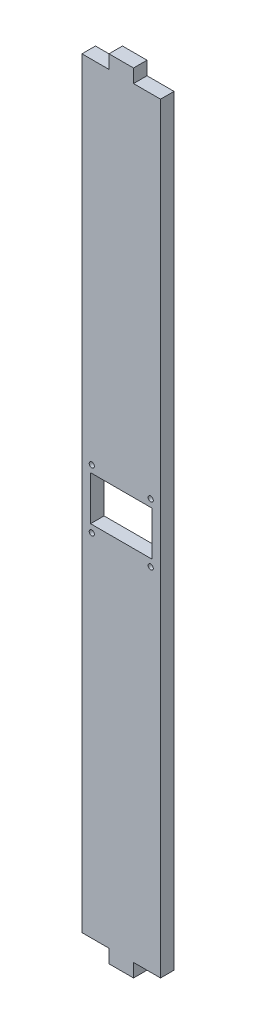
from build123d import *

# Parameters (mm, degrees)
SKETCH_1_W          = 32
SKETCH_1_H          = 321
EXTRUDE_1_DEPTH     = 5.5
SKETCH_2_R          = 1.05
SKETCH_2_W          = 25
SKETCH_2_H          = 18
CUT_EXTRUDE_1_DEPTH = 162.389280933
SKETCH_3_W          = 11
SKETCH_3_H          = 5.5
CUT_EXTRUDE_2_DEPTH = 162.389280933


with BuildPart() as part:
    # ｽｹｯﾁ1 → ﾎﾞｽ - 押し出し1 (new body)
    with BuildSketch(Plane.XY):
        Rectangle(SKETCH_1_W, SKETCH_1_H)
    extrude(amount=EXTRUDE_1_DEPTH)

    # ｽｹｯﾁ2 → ｶｯﾄ - 押し出し1 (cut, through all)
    with BuildSketch(Plane.XY.offset(5.5)):
        with Locations((12, 12)):
            Circle(SKETCH_2_R)
        with Locations((12, -12)):
            Circle(SKETCH_2_R)
        with Locations((-12, 12)):
            Circle(SKETCH_2_R)
        with Locations((-12, -12)):
            Circle(SKETCH_2_R)
        Rectangle(SKETCH_2_W, SKETCH_2_H)
    extrude(amount=-CUT_EXTRUDE_1_DEPTH, mode=Mode.SUBTRACT)

    # ｽｹｯﾁ3 → ｶｯﾄ - 押し出し2 (cut, through all)
    with BuildSketch(Plane.XY.offset(5.5)):
        with Locations((-10.5, 157.75)):
            Rectangle(SKETCH_3_W, SKETCH_3_H)
        with Locations((10.5, 157.75)):
            Rectangle(SKETCH_3_W, SKETCH_3_H)
        with Locations((10.5, -157.75)):
            Rectangle(SKETCH_3_W, SKETCH_3_H)
        with Locations((-10.5, -157.75)):
            Rectangle(SKETCH_3_W, SKETCH_3_H)
    extrude(amount=-CUT_EXTRUDE_2_DEPTH, mode=Mode.SUBTRACT)


solid = part.part
